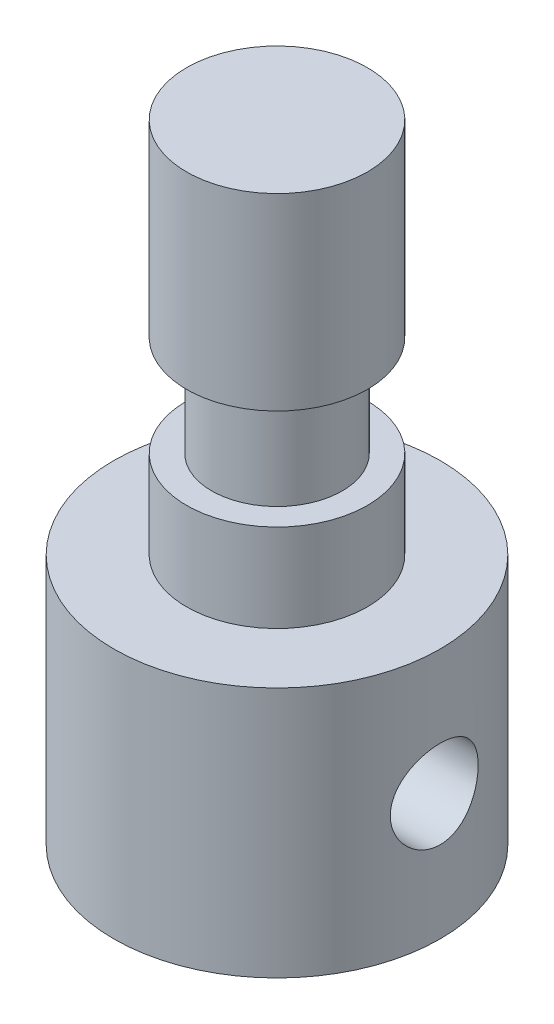
from build123d import *

# Parameters (mm, degrees)
CUT_EXTRUDE1_DEPTH      = 27.636441204
CUT_EXTRUDE1_DEPTH_BACK = 27.636441204
SKETCH2_R               = 1.75


with BuildPart() as part:
    # Sketch1 → Revolve1 (revolve)
    with BuildSketch(Plane.XY):
        Polygon((0, 0), (-6.5, 0), (-6.5, 10), (-3.6, 10), (-3.6, 13.5), (-2.6, 13.5), (-2.6, 17.5), (-3.6, 17.5), (-3.6, 25), (0, 25), align=None)
    revolve(axis=Axis((0, 25, 0), (0, -1, 0)))

    # Sketch2 → Cut-Extrude1 (cut, two sides: drawn at the far end of the back side and taken through both)
    with BuildSketch(Plane(origin=(0, 0, 0), x_dir=(0, 0, -1), z_dir=(1, 0, 0)).offset(-CUT_EXTRUDE1_DEPTH_BACK)):
        with Locations((0, 5)):
            Circle(SKETCH2_R)
    extrude(amount=CUT_EXTRUDE1_DEPTH + CUT_EXTRUDE1_DEPTH_BACK, mode=Mode.SUBTRACT)


solid = part.part
